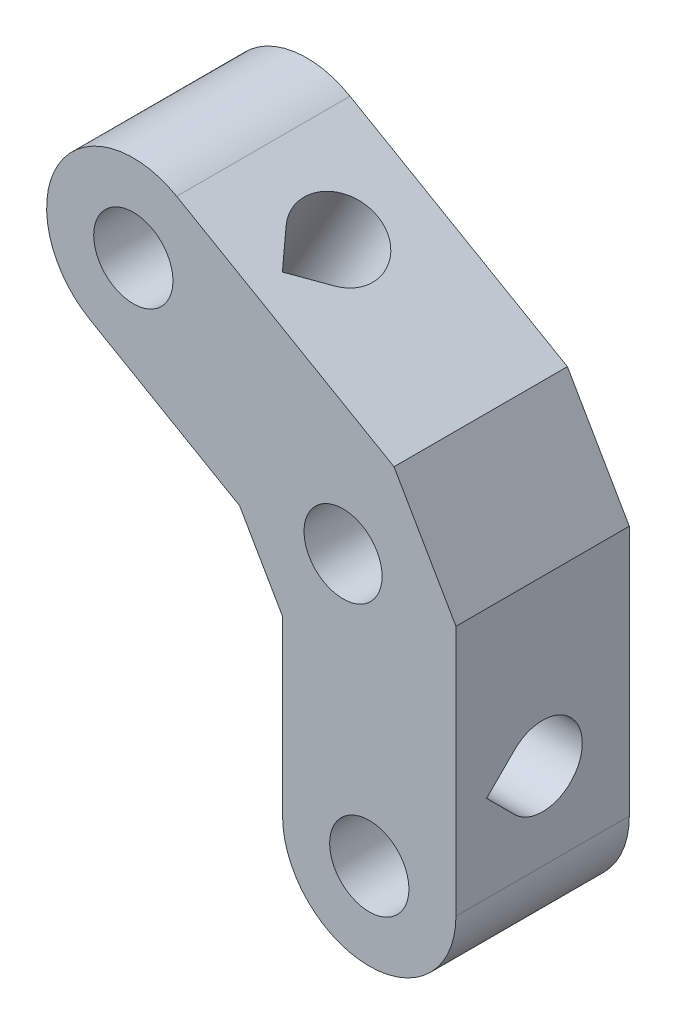
from build123d import *

# Parameters (mm, degrees)
BOSS_EXTRUDE1_DEPTH = 14
HOLE1_D             = 6.4
HOLE2_D             = 6.4
CUT_EXTRUDE1_DEPTH  = 46.814563472
CUT_EXTRUDE2_DEPTH  = 47.465040622
SKETCH8_R           = 3.15
CUT_EXTRUDE3_DEPTH  = 50.746716719


with BuildPart() as part:
    # Sketch1 → Boss-Extrude1 (new body)
    with BuildSketch(Plane.XY.offset(14)):
        with BuildLine():
            Line((7, 0), (7, 20.267949192))
            Line((7, 20.267949192), (2, 28.92820323))
            Line((2, 28.92820323), (-15.552558883, 39.062177826))
            ThreePointArc((-15.552558883, 39.062177826), (-25.11473671, 36.5), (-22.552558883, 26.937822174))
            Line((-22.552558883, 26.937822174), (-10.464101615, 19.958548116))
            Line((-10.464101615, 19.958548116), (-7, 13.958548116))
            Line((-7, 13.958548116), (-7, 0))
            ThreePointArc((-7, 0), (0, -7), (7, 0))
        make_face()
    extrude(amount=-BOSS_EXTRUDE1_DEPTH)

    # Hole1 (through all)
    with Locations(Plane(origin=(0, 0, 0), x_dir=(-1, 0, 0), z_dir=(0, 0, -1))):
        with Locations((0, 0)):
            Hole(HOLE1_D / 2)

    # Hole2 (through all)
    with Locations(Plane(origin=(0, 0, 0), x_dir=(-1, 0, 0), z_dir=(0, 0, -1))):
        with Locations((19.0525, 32.999898011)):
            Hole(HOLE2_D / 2)

    # Sketch2 → Cut-Extrude1 (cut, through all)
    with BuildSketch(Plane(origin=(6.026279442, 10.437822174, 0), x_dir=(0.8660254037844398, -0.49999999999999806, 0), z_dir=(-0.499999999999998, -0.8660254037844397, 0))):
        with BuildLine():
            Line((-25.999898011, 11.5254834), (-28.262639711, 9.2627417))
            ThreePointArc((-28.262639711, 9.2627417), (-25.999898011, 3.8), (-23.737156311, 9.2627417))
            Line((-23.737156311, 9.2627417), (-25.999898011, 11.5254834))
        make_face()
    extrude(amount=-CUT_EXTRUDE1_DEPTH, mode=Mode.SUBTRACT)

    # Sketch3 → Cut-Extrude2 (cut, through all)
    with BuildSketch(Plane.ZY.offset(7)):
        with BuildLine():
            Line((9.2627417, 4.7372583), (11.5254834, 7))
            Line((11.5254834, 7), (9.2627417, 9.2627417))
            ThreePointArc((9.2627417, 9.2627417), (3.8, 7), (9.2627417, 4.7372583))
        make_face()
    extrude(amount=-CUT_EXTRUDE2_DEPTH, mode=Mode.SUBTRACT)

    # Sketch8 → Cut-Extrude3 (cut, through all)
    with BuildSketch(Plane.XY.offset(14)):
        with Locations((-2.116025404, 20.778312164)):
            Circle(SKETCH8_R)
    extrude(amount=-CUT_EXTRUDE3_DEPTH, mode=Mode.SUBTRACT)


solid = part.part
